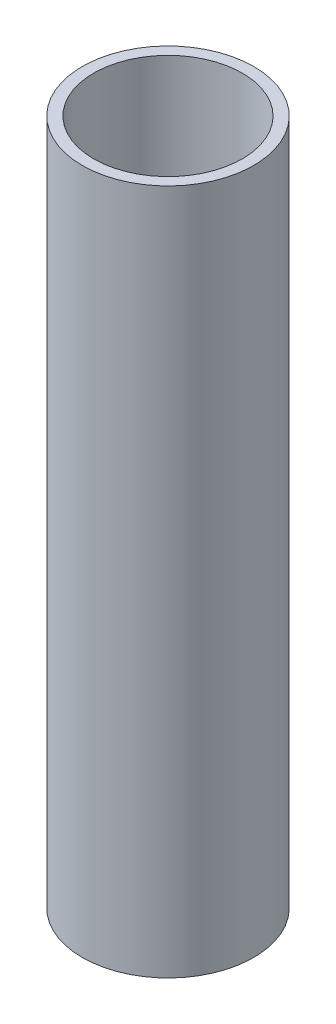
from build123d import *

# Parameters (mm, degrees)
SKETCH1_R           = 19.05
SKETCH1_R_2         = 16.51
EXTRUDE_THIN1_DEPTH = 152.4


with BuildPart() as part:
    # Sketch1 → Extrude-Thin1 (new body)
    with BuildSketch(Plane(origin=(0, 0, 0), x_dir=(1, 0, 0), z_dir=(0, 1, 0))):
        Circle(SKETCH1_R)
        Circle(SKETCH1_R_2, mode=Mode.SUBTRACT)
    extrude(amount=-EXTRUDE_THIN1_DEPTH)


solid = part.part
